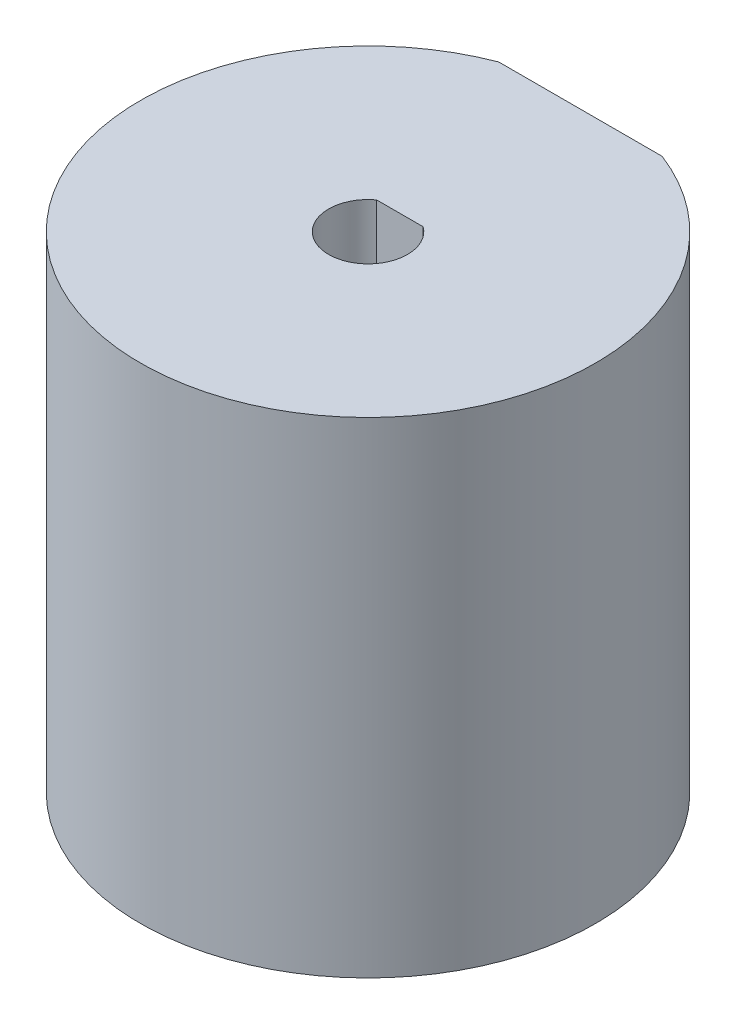
from build123d import *

# Parameters (mm, degrees)
SKETCH1_R               = 6
BOSS_EXTRUDE1_DEPTH     = 5
BOSS_EXTRUDE2_START     = -5
BOSS_EXTRUDE2_DEPTH     = 5
CUT_EXTRUDE1_DEPTH      = 5
SKETCH4_R               = 15
BOSS_EXTRUDE3_DEPTH     = 15
SKETCH5_R               = 15
BOSS_EXTRUDE4_DEPTH     = 2
SKETCH6_R               = 15
SKETCH6_W               = 16
SKETCH6_H               = 16
BOSS_EXTRUDE5_DEPTH     = 15
CUT_EXTRUDE2_DEPTH      = 51
CUT_EXTRUDE5_DEPTH      = 1
CUT_EXTRUDE5_DEPTH_BACK = 51
SKETCH10_R              = 2.6
CUT_EXTRUDE6_DEPTH      = 7


with BuildPart() as part:
    # Sketch1 → Boss-Extrude1 (new body)
    with BuildSketch(Plane(origin=(0, 0, 0), x_dir=(1, 0, 0), z_dir=(0, 1, 0))):
        with Locations(Location((0, 0, 0), (0, 0, 270))):
            Circle(SKETCH1_R)
        with BuildLine():
            ThreePointArc((-1.549193338, 2.15), (0, -2.65), (1.549193338, 2.15))
            Line((1.549193338, 2.15), (-1.549193338, 2.15))
        make_face(mode=Mode.SUBTRACT)
    extrude(amount=BOSS_EXTRUDE1_DEPTH)

    # Sketch2 → Boss-Extrude2 (add)
    with BuildSketch(Plane(origin=(0, 5, 0), x_dir=(1, 0, 0), z_dir=(0, 1, 0)).offset(BOSS_EXTRUDE2_START)):
        with BuildLine():
            Line((1.549193338, 2.15), (-1.549193338, 2.15))
            ThreePointArc((-1.549193338, 2.15), (0, -2.65), (1.549193338, 2.15))
        make_face()
        with BuildLine():
            Line((1.526433752, 2.08), (-1.526433752, 2.08))
            ThreePointArc((-1.526433752, 2.08), (0, -2.58), (1.526433752, 2.08))
        make_face(mode=Mode.SUBTRACT)
    extrude(amount=BOSS_EXTRUDE2_DEPTH)

    # Sketch3 → Cut-Extrude1 (cut)
    with BuildSketch(Plane(origin=(0, 5, 0), x_dir=(1, 0, 0), z_dir=(0, 1, 0))):
        with BuildLine():
            Line((1.532970972, 2.1), (-1.532970972, 2.1))
            ThreePointArc((-1.532970972, 2.1), (0, -2.6), (1.532970972, 2.1))
        make_face()
    extrude(amount=-CUT_EXTRUDE1_DEPTH, mode=Mode.SUBTRACT)

    # Sketch4 → Boss-Extrude3 (add)
    with BuildSketch(Plane(origin=(0, 5, 0), x_dir=(1, 0, 0), z_dir=(0, 1, 0))):
        with Locations(Location((0, 0, 0), (0, 0, 270))):
            Circle(SKETCH4_R)
        with BuildLine():
            Line((1.532970972, 2.1), (-1.532970972, 2.1))
            ThreePointArc((-1.532970972, 2.1), (0, -2.6), (1.532970972, 2.1))
        make_face(mode=Mode.SUBTRACT)
    extrude(amount=-BOSS_EXTRUDE3_DEPTH)

    # Sketch5 → Boss-Extrude4 (add)
    with BuildSketch(Plane.XZ.offset(10)):
        with Locations(Location((0, 0, 0), (0, 0, 90))):
            Circle(SKETCH5_R)
    extrude(amount=BOSS_EXTRUDE4_DEPTH)

    # Sketch6 → Boss-Extrude5 (add)
    with BuildSketch(Plane.XZ.offset(12)):
        with Locations(Location((0, 0, 0), (0, 0, 90))):
            Circle(SKETCH6_R)
        Rectangle(SKETCH6_W, SKETCH6_H, mode=Mode.SUBTRACT)
    extrude(amount=BOSS_EXTRUDE5_DEPTH)

    # Sketch7 → Cut-Extrude2 (cut)
    with BuildSketch(Plane(origin=(0, 5, 0), x_dir=(1, 0, 0), z_dir=(0, 1, 0))):
        with BuildLine():
            Line((0, 14), (0, 15))
            ThreePointArc((0, 15), (-2.738612788, 14.747881204), (-5.385164807, 14))
            Line((-5.385164807, 14), (0, 14))
        make_face()
        with BuildLine():
            ThreePointArc((5.385164807, 14), (2.738612788, 14.747881204), (0, 15))
            Line((0, 15), (0, 14))
            Line((0, 14), (5.385164807, 14))
        make_face()
    extrude(amount=-CUT_EXTRUDE2_DEPTH, mode=Mode.SUBTRACT)

    # Sketch8 → Cut-Extrude5 (cut, two sides: drawn at the far end of the back side and taken through both)
    with BuildSketch(Plane.XY.offset(-2.1).offset(-CUT_EXTRUDE5_DEPTH_BACK)):
        with BuildLine():
            Line((1.532970972, -2.041742431), (1.532970972, -2.5))
            Line((1.532970972, -2.5), (1.532970972, -2.958257569))
            ThreePointArc((1.532970972, -2.958257569), (1.58315406, -2.731566886), (1.6, -2.5))
            ThreePointArc((1.6, -2.5), (1.58315406, -2.268433114), (1.532970972, -2.041742431))
        make_face()
        with BuildLine():
            Line((-1.532970972, -2.041742431), (-1.532970972, -2.5))
            Line((-1.532970972, -2.5), (1.532970972, -2.5))
            Line((1.532970972, -2.5), (1.532970972, -2.041742431))
            ThreePointArc((1.532970972, -2.041742431), (0, -0.9), (-1.532970972, -2.041742431))
        make_face()
        with BuildLine():
            Line((1.532970972, -2.5), (-1.532970972, -2.5))
            Line((-1.532970972, -2.5), (-1.532970972, -2.958257569))
            ThreePointArc((-1.532970972, -2.958257569), (0, -4.1), (1.532970972, -2.958257569))
            Line((1.532970972, -2.958257569), (1.532970972, -2.5))
        make_face()
        with BuildLine():
            Line((-1.532970972, -2.958257569), (-1.532970972, -2.5))
            Line((-1.532970972, -2.5), (-1.532970972, -2.041742431))
            ThreePointArc((-1.532970972, -2.041742431), (-1.6, -2.5), (-1.532970972, -2.958257569))
        make_face()
    extrude(amount=CUT_EXTRUDE5_DEPTH + CUT_EXTRUDE5_DEPTH_BACK, mode=Mode.SUBTRACT)

    # Sketch10 → Cut-Extrude6 (cut)
    with BuildSketch(Plane(origin=(0, 0, -14), x_dir=(-1, 0, 0), z_dir=(0, 0, -1))):
        with Locations((0, -2.5)):
            Circle(SKETCH10_R)
    extrude(amount=-CUT_EXTRUDE6_DEPTH, mode=Mode.SUBTRACT)


solid = part.part
